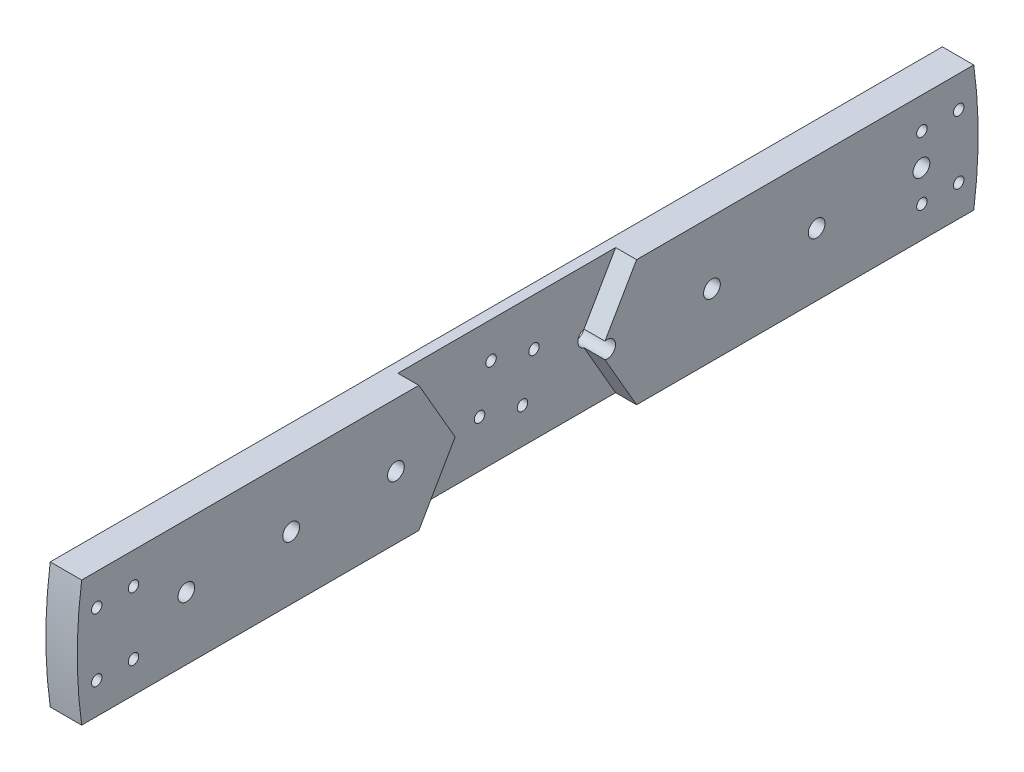
from build123d import *

# Parameters (mm, degrees)
SKETCH2_R           = 5.08
SKETCH2_R_2         = 3.175
BOSS_EXTRUDE1_DEPTH = 19.05
SKETCH3_R           = 3.175
CUT_EXTRUDE1_DEPTH  = 12.7
SKETCH3_3_R         = 3.175
CUT_EXTRUDE2_DEPTH  = 277.352700367


with BuildPart() as part:
    # Sketch2 → Boss-Extrude1 (new body)
    with BuildSketch(Plane(origin=(0, 0, 0), x_dir=(0, 0, -1), z_dir=(1, 0, 0))):
        with BuildLine():
            ThreePointArc((-270.378794472, 38.1), (-273.05, 0), (-270.378794472, -38.1))
            Line((-270.378794472, -38.1), (270.378794472, -38.1))
            ThreePointArc((270.378794472, -38.1), (273.05, 0), (270.378794472, 38.1))
            Line((270.378794472, 38.1), (-270.378794472, 38.1))
        make_face()
        with Locations((-79.903910151, 0)):
            Circle(SKETCH2_R, mode=Mode.SUBTRACT)
        with Locations((-206.903531715, 0)):
            Circle(SKETCH2_R, mode=Mode.SUBTRACT)
        with Locations((-143.403723055, 0)):
            Circle(SKETCH2_R, mode=Mode.SUBTRACT)
        with Locations((175.153627627, 0)):
            Circle(SKETCH2_R, mode=Mode.SUBTRACT)
        with Locations((111.653817586, 0)):
            Circle(SKETCH2_R, mode=Mode.SUBTRACT)
        with Locations((48.15399686, 0)):
            Circle(SKETCH2_R, mode=Mode.SUBTRACT)
        with Locations((-238.949490115, 19.110830171)):
            Circle(SKETCH2_R_2, mode=Mode.SUBTRACT)
        with Locations((-261.240141142, -19.100852393)):
            Circle(SKETCH2_R_2, mode=Mode.SUBTRACT)
        with Locations((-238.949490115, -19.110830171)):
            Circle(SKETCH2_R_2, mode=Mode.SUBTRACT)
        with Locations((-261.240141142, 19.100852393)):
            Circle(SKETCH2_R_2, mode=Mode.SUBTRACT)
        with Locations((261.240141142, 19.100852393)):
            Circle(SKETCH2_R_2, mode=Mode.SUBTRACT)
        with Locations((238.949490115, 19.110830171)):
            Circle(SKETCH2_R_2, mode=Mode.SUBTRACT)
        with Locations((238.653435513, 0)):
            Circle(SKETCH2_R, mode=Mode.SUBTRACT)
        with Locations((238.949490115, -19.110830171)):
            Circle(SKETCH2_R_2, mode=Mode.SUBTRACT)
        with Locations((261.240141142, -19.100852393)):
            Circle(SKETCH2_R_2, mode=Mode.SUBTRACT)
    extrude(amount=BOSS_EXTRUDE1_DEPTH)

    # Sketch3 → Cut-Extrude1 (cut)
    with BuildSketch(Plane(origin=(19.05, 0, 0), x_dir=(0, 0, -1), z_dir=(1, 0, 0))):
        Polygon((-65.991135768, -38.1), (65.991135768, -38.1), (43.994090512, 0), (65.991135768, 38.1), (-65.991135768, 38.1), (-43.994090512, 0), align=None)
        with Locations((-16.497783942, -9.525)):
            Circle(SKETCH3_R, mode=Mode.SUBTRACT)
        with Locations((9.525, -16.497783942)):
            Circle(SKETCH3_R, mode=Mode.SUBTRACT)
        with Locations((-9.525, 16.497783942)):
            Circle(SKETCH3_R, mode=Mode.SUBTRACT)
        with Locations((16.497783942, 9.525)):
            Circle(SKETCH3_R, mode=Mode.SUBTRACT)
    extrude(amount=-CUT_EXTRUDE1_DEPTH, mode=Mode.SUBTRACT)

    # Sketch3<3> → Cut-Extrude2 (cut, through all)
    with BuildSketch(Plane(origin=(19.05, 0, 0), x_dir=(0, 0, -1), z_dir=(1, 0, 0))):
        with Locations((-9.525, 16.497783942)):
            Circle(SKETCH3_3_R)
        with Locations((-16.497783942, -9.525)):
            Circle(SKETCH3_3_R)
        with Locations((9.525, -16.497783942)):
            Circle(SKETCH3_3_R)
        with Locations((16.497783942, 9.525)):
            Circle(SKETCH3_3_R)
    extrude(amount=-CUT_EXTRUDE2_DEPTH, mode=Mode.SUBTRACT)


solid = part.part
